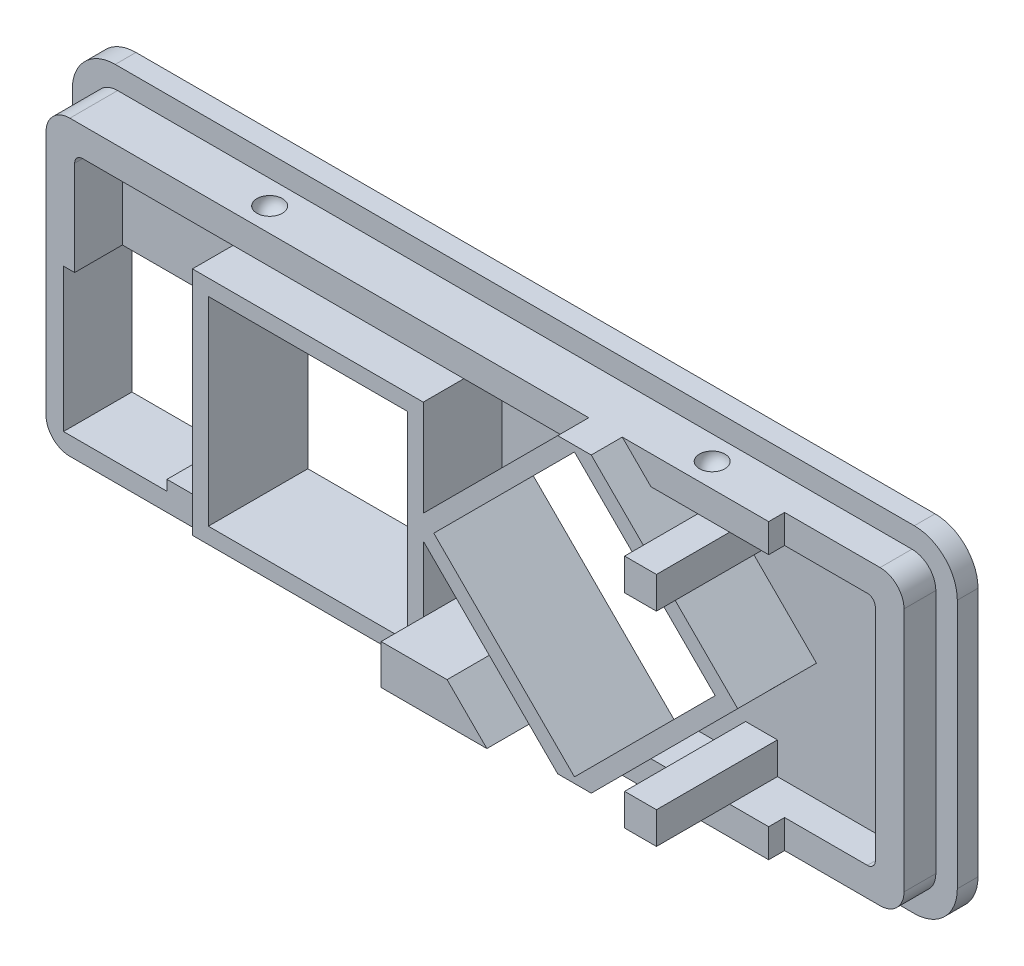
from build123d import *

# Parameters (mm, degrees)
BOSS_EXTRUDE1_DEPTH = 1.3
BOSS_EXTRUDE3_DEPTH = 3
CUT_EXTRUDE1_DEPTH  = 3
SKETCH11_W          = 6.5
SKETCH11_H          = 9
CUT_EXTRUDE2_DEPTH  = 4.3
SKETCH12_W          = 12.5
SKETCH12_H          = 12.5
CUT_EXTRUDE4_DEPTH  = 1.3
SKETCH17_W          = 14.5
SKETCH17_H          = 14.5
SKETCH17_W_2        = 12.5
SKETCH17_H_2        = 12.5
BOSS_EXTRUDE4_DEPTH = 6.25
CUT_EXTRUDE5_DEPTH  = 4.3
BOSS_EXTRUDE5_DEPTH = 6.25
CUT_EXTRUDE6_START  = -3
CUT_EXTRUDE6_DEPTH  = 23
SKETCH21_W          = 2.5
SKETCH21_H          = 2.5
CUT_EXTRUDE7_DEPTH  = 10
BOSS_EXTRUDE7_DEPTH = 7.6
SKETCH25_W          = 2
SKETCH25_H          = 2
BOSS_EXTRUDE8_DEPTH = 7.6
SKETCH27_W          = 1
SKETCH27_H          = 18.4
CUT_EXTRUDE8_DEPTH  = 7.5


with BuildPart() as part:
    # Sketch1 → Boss-Extrude1 (new body)
    with BuildSketch(Plane.XY):
        with BuildLine():
            Line((2.7, 0), (52.9, 0))
            ThreePointArc((52.9, 0), (54.809188309, 0.790811691), (55.6, 2.7))
            Line((55.6, 2.7), (55.6, 18.4))
            ThreePointArc((55.6, 18.4), (54.809188309, 20.309188309), (52.9, 21.1))
            Line((52.9, 21.1), (2.7, 21.1))
            ThreePointArc((2.7, 21.1), (0.790811691, 20.309188309), (0, 18.4))
            Line((0, 18.4), (0, 2.7))
            ThreePointArc((0, 2.7), (0.790811691, 0.790811691), (2.7, 0))
        make_face()
    extrude(amount=BOSS_EXTRUDE1_DEPTH)

    # Sketch4 → Boss-Extrude3 (add)
    with BuildSketch(Plane.XY.offset(1.3)):
        with BuildLine():
            Line((54.25, 2.85), (54.25, 18.25))
            ThreePointArc((54.25, 18.25), (53.810660172, 19.310660172), (52.75, 19.75))
            Line((52.75, 19.75), (2.85, 19.75))
            ThreePointArc((2.85, 19.75), (1.789339828, 19.310660172), (1.35, 18.25))
            Line((1.35, 18.25), (1.35, 2.85))
            ThreePointArc((1.35, 2.85), (1.789339828, 1.789339828), (2.85, 1.35))
            Line((2.85, 1.35), (52.75, 1.35))
            ThreePointArc((52.75, 1.35), (53.810660172, 1.789339828), (54.25, 2.85))
        make_face()
    extrude(amount=BOSS_EXTRUDE3_DEPTH)

    # Sketch5 → Cut-Extrude1 (cut)
    with BuildSketch(Plane.XY.offset(4.3)):
        with BuildLine():
            Line((51.95, 17.95), (3.65, 17.95))
            ThreePointArc((3.65, 17.95), (3.296446609, 17.803553391), (3.15, 17.45))
            Line((3.15, 17.45), (3.15, 3.65))
            ThreePointArc((3.15, 3.65), (3.296446609, 3.296446609), (3.65, 3.15))
            Line((3.65, 3.15), (51.95, 3.15))
            ThreePointArc((51.95, 3.15), (52.303553391, 3.296446609), (52.45, 3.65))
            Line((52.45, 3.65), (52.45, 17.45))
            ThreePointArc((52.45, 17.45), (52.303553391, 17.803553391), (51.95, 17.95))
        make_face()
    extrude(amount=-CUT_EXTRUDE1_DEPTH, mode=Mode.SUBTRACT)

    # Sketch10 → Cut-Revolve1 (revolve, cut)
    with BuildSketch(Plane(origin=(0, 19.75, 0), x_dir=(1, 0, 0), z_dir=(0, 1, 0))):
        with BuildLine():
            Line((41.7, -2), (41.7, -3.6))
            ThreePointArc((41.7, -3.6), (40.9, -2.8), (41.7, -2))
        make_face()
    cut_revolve1 = revolve(axis=Axis((41.7, 19.75, 2), (0, 0, 1)), mode=Mode.SUBTRACT)

    # Mirror1: Cut-Revolve1 across plane
    add(cut_revolve1.mirror(Plane(origin=(0, 10.55, 0), x_dir=(0, 0, 1), z_dir=(0, -1, 0))), mode=Mode.SUBTRACT)

    # Sketch11 → Cut-Extrude2 (cut)
    with BuildSketch(Plane(origin=(0, 0, 0), x_dir=(-1, 0, 0), z_dir=(0, 0, -1))):
        with Locations((-5.7, 7)):
            Rectangle(SKETCH11_W, SKETCH11_H)
    extrude(amount=-CUT_EXTRUDE2_DEPTH, mode=Mode.SUBTRACT)

    # Sketch12 → Cut-Extrude4 (cut)
    with BuildSketch(Plane(origin=(0, 0, 0), x_dir=(-1, 0, 0), z_dir=(0, 0, -1))):
        with Locations((-19.75, 10.1)):
            Rectangle(SKETCH12_W, SKETCH12_H)
    extrude(amount=-CUT_EXTRUDE4_DEPTH, mode=Mode.SUBTRACT)

    # Sketch17 → Boss-Extrude4 (add)
    with BuildSketch(Plane(origin=(0, 0, 0), x_dir=(-1, 0, 0), z_dir=(0, 0, -1))):
        with Locations((-19.75, 10.1)):
            Rectangle(SKETCH17_W, SKETCH17_H)
        with Locations((-19.75, 10.1)):
            Rectangle(SKETCH17_W_2, SKETCH17_H_2, mode=Mode.SUBTRACT)
    extrude(amount=-BOSS_EXTRUDE4_DEPTH)

    # Sketch13 → Cut-Extrude5 (cut)
    with BuildSketch(Plane(origin=(0, 0, 0), x_dir=(-1, 0, 0), z_dir=(0, 0, -1))):
        Polygon((-45.338834765, 10.55), (-36.5, 1.711165235), (-27.661165235, 10.55), (-36.5, 19.388834765), align=None)
    extrude(amount=-CUT_EXTRUDE5_DEPTH, mode=Mode.SUBTRACT)

    # Sketch18 → Boss-Extrude5 (add)
    with BuildSketch(Plane(origin=(0, 0, 0), x_dir=(-1, 0, 0), z_dir=(0, 0, -1))):
        Polygon((-46.753048327, 10.55), (-36.5, 0.296951673), (-26.246951673, 10.55), (-36.5, 20.803048327), align=None)
        Polygon((-36.5, 19.388834765), (-45.338834765, 10.55), (-36.5, 1.711165235), (-27.661165235, 10.55), align=None, mode=Mode.SUBTRACT)
    extrude(amount=-BOSS_EXTRUDE5_DEPTH)

    # Sketch20 → Cut-Extrude6 (cut)
    with BuildSketch(Plane.XY.offset(4.3).offset(CUT_EXTRUDE6_START)):
        Polygon((35.446951673, 19.75), (37.553048327, 19.75), (36.5, 20.803048327), align=None)
    cut_extrude6 = extrude(amount=CUT_EXTRUDE6_DEPTH, mode=Mode.SUBTRACT)

    # Mirror2: Cut-Extrude6 across plane
    add(cut_extrude6.mirror(Plane(origin=(0, 10.55, 0), x_dir=(0, 0, 1), z_dir=(0, -1, 0))), mode=Mode.SUBTRACT)

    # Sketch21 → Cut-Extrude7 (cut)
    with BuildSketch(Plane(origin=(0, 0, 0), x_dir=(-1, 0, 0), z_dir=(0, 0, -1))):
        with Locations((-29, 16.6)):
            Rectangle(SKETCH21_W, SKETCH21_H)
    extrude(amount=-CUT_EXTRUDE7_DEPTH, mode=Mode.SUBTRACT)

    # Mirror3: Cut-Revolve1 across plane
    add(cut_revolve1.mirror(Plane.ZY.offset(-27.8)), mode=Mode.SUBTRACT)

    # Mirror3 copy 1 sketch → Mirror3 copy 1 (revolve, cut)
    with BuildSketch(Plane(origin=(55.6, 1.35, 0), x_dir=(-1, 0, 0), z_dir=(0, -1, 0))):
        with BuildLine():
            Line((41.7, -2), (41.7, -3.6))
            ThreePointArc((41.7, -3.6), (40.9, -2.8), (41.7, -2))
        make_face()
    revolve(axis=Axis((13.9, 1.35, 2), (0, 0, 1)), mode=Mode.SUBTRACT)

    # Sketch24 → Boss-Extrude7 (add)
    with BuildSketch(Plane.XY.offset(1.3)):
        Polygon((33.646951673, 3.15), (27, 3.15), (27, 5.65), (31.146951673, 5.65), align=None)
    extrude(amount=BOSS_EXTRUDE7_DEPTH)

    # Sketch25 → Boss-Extrude8 (add)
    with BuildSketch(Plane.XY.offset(1.3)):
        with Locations((43.3, 4.15)):
            Rectangle(SKETCH25_W, SKETCH25_H)
    boss_extrude8 = extrude(amount=BOSS_EXTRUDE8_DEPTH)

    # Mirror4: Boss-Extrude8 across plane
    add(boss_extrude8.mirror(Plane(origin=(0, 10.55, 0), x_dir=(0, 0, 1), z_dir=(0, -1, 0))))

    # Sketch27 → Cut-Extrude8 (cut)
    with BuildSketch(Plane(origin=(54.25, 0, 0), x_dir=(0, 0, -1), z_dir=(1, 0, 0))):
        with Locations((-3.8, 10.55)):
            Rectangle(SKETCH27_W, SKETCH27_H)
    extrude(amount=-CUT_EXTRUDE8_DEPTH, mode=Mode.SUBTRACT)


solid = part.part
